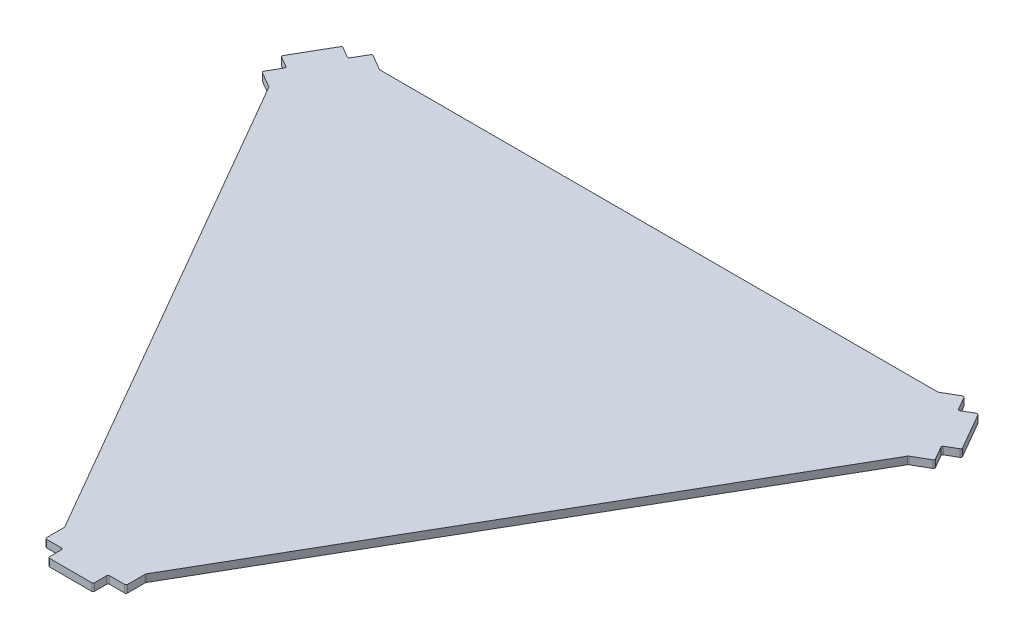
from build123d import *

# Parameters (mm, degrees)
EXTRUDE_1_DEPTH = 5


with BuildPart() as part:
    # 草圖1 → 填料-伸長1 (new body)
    with BuildSketch(Plane(origin=(0, 0, 0), x_dir=(1, 0, 0), z_dir=(0, 1, 0))):
        with BuildLine():
            Line((27.133974596, -175.834936491), (47, -141.425971147))
            Line((47, -141.425971147), (193.042249331, 111.526624746))
            Line((193.042249331, 111.526624746), (212.908274735, 145.93559009))
            ThreePointArc((212.908274735, 145.93559009), (213.067193357, 146.142696871), (213.274300139, 146.301615494))
            Line((213.274300139, 146.301615494), (223.434554176, 152.167640898))
            ThreePointArc((223.434554176, 152.167640898), (223.900480003, 152.774847256), (223.80057958, 153.533666301))
            Line((223.80057958, 153.533666301), (218.80057958, 162.193920339))
            ThreePointArc((218.80057958, 162.193920339), (218.700679158, 162.952739384), (219.166604984, 163.559945743))
            Line((219.166604984, 163.559945743), (226.094808214, 167.559945743))
            ThreePointArc((226.094808214, 167.559945743), (226.560734041, 168.167152102), (226.460833618, 168.925971147))
            Line((226.460833618, 168.925971147), (212.460833618, 193.174682453))
            ThreePointArc((212.460833618, 193.174682453), (211.853627259, 193.640608279), (211.094808214, 193.540707856))
            Line((211.094808214, 193.540707856), (204.166604984, 189.540707856))
            ThreePointArc((204.166604984, 189.540707856), (203.407785939, 189.440807434), (202.80057958, 189.90673326))
            Line((202.80057958, 189.90673326), (197.80057958, 198.566987298))
            ThreePointArc((197.80057958, 198.566987298), (197.193373221, 199.032913124), (196.434554176, 198.933012702))
            Line((196.434554176, 198.933012702), (186.274300139, 193.066987298))
            ThreePointArc((186.274300139, 193.066987298), (186.033119184, 192.967086876), (185.774300139, 192.933012702))
            Line((185.774300139, 192.933012702), (146.042249331, 192.933012702))
            Line((146.042249331, 192.933012702), (-146.042249331, 192.933012702))
            Line((-146.042249331, 192.933012702), (-185.774300139, 192.933012702))
            ThreePointArc((-185.774300139, 192.933012702), (-186.033119184, 192.967086876), (-186.274300139, 193.066987298))
            Line((-186.274300139, 193.066987298), (-196.434554176, 198.933012702))
            ThreePointArc((-196.434554176, 198.933012702), (-197.193373221, 199.032913124), (-197.80057958, 198.566987298))
            Line((-197.80057958, 198.566987298), (-202.80057958, 189.90673326))
            ThreePointArc((-202.80057958, 189.90673326), (-203.407785939, 189.440807434), (-204.166604984, 189.540707856))
            Line((-204.166604984, 189.540707856), (-211.094808214, 193.540707856))
            ThreePointArc((-211.094808214, 193.540707856), (-211.853627259, 193.640608279), (-212.460833618, 193.174682453))
            Line((-212.460833618, 193.174682453), (-226.460833618, 168.925971147))
            ThreePointArc((-226.460833618, 168.925971147), (-226.560734041, 168.167152102), (-226.094808214, 167.559945743))
            Line((-226.094808214, 167.559945743), (-219.166604984, 163.559945743))
            ThreePointArc((-219.166604984, 163.559945743), (-218.700679158, 162.952739384), (-218.80057958, 162.193920339))
            Line((-218.80057958, 162.193920339), (-223.80057958, 153.533666301))
            ThreePointArc((-223.80057958, 153.533666301), (-223.900480003, 152.774847256), (-223.434554176, 152.167640898))
            Line((-223.434554176, 152.167640898), (-213.274300139, 146.301615494))
            ThreePointArc((-213.274300139, 146.301615494), (-213.067193357, 146.142696871), (-212.908274735, 145.93559009))
            Line((-212.908274735, 145.93559009), (-193.042249331, 111.526624746))
            Line((-193.042249331, 111.526624746), (-47, -141.425971147))
            Line((-47, -141.425971147), (-27.133974596, -175.834936491))
            ThreePointArc((-27.133974596, -175.834936491), (-27.034074174, -176.076117445), (-27, -176.334936491))
            Line((-27, -176.334936491), (-27, -188.066987298))
            ThreePointArc((-27, -188.066987298), (-26.707106781, -188.774094079), (-26, -189.066987298))
            Line((-26, -189.066987298), (-16, -189.066987298))
            ThreePointArc((-16, -189.066987298), (-15.292893219, -189.359880517), (-15, -190.066987298))
            Line((-15, -190.066987298), (-15, -198.066987298))
            ThreePointArc((-15, -198.066987298), (-14.707106781, -198.774094079), (-14, -199.066987298))
            Line((-14, -199.066987298), (14, -199.066987298))
            ThreePointArc((14, -199.066987298), (14.707106781, -198.774094079), (15, -198.066987298))
            Line((15, -198.066987298), (15, -190.066987298))
            ThreePointArc((15, -190.066987298), (15.292893219, -189.359880517), (16, -189.066987298))
            Line((16, -189.066987298), (26, -189.066987298))
            ThreePointArc((26, -189.066987298), (26.707106781, -188.774094079), (27, -188.066987298))
            Line((27, -188.066987298), (27, -176.334936491))
            ThreePointArc((27, -176.334936491), (27.034074174, -176.076117445), (27.133974596, -175.834936491))
        make_face()
    extrude(amount=EXTRUDE_1_DEPTH)


solid = part.part
